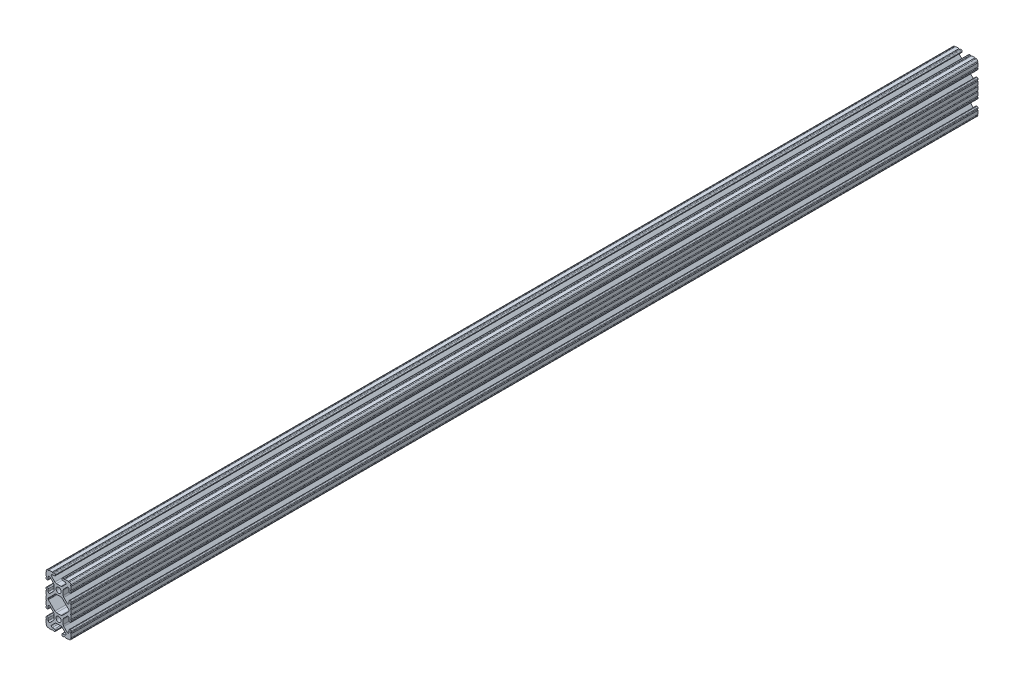
from build123d import *

# Parameters (mm, degrees)
BOSS_EXTRUDE1_DEPTH     = 457.2
CUT_EXTRUDE1_DEPTH      = 459.081095441
CUT_EXTRUDE1_DEPTH_BACK = 459.081095441
SKETCH5_R               = 0.55245
BOSS_EXTRUDE2_DEPTH     = 457.2
CUT_EXTRUDE2_DEPTH      = 459.081095441
CUT_EXTRUDE2_DEPTH_BACK = 459.081095441


with BuildPart() as part:
    # Sketch4 → Boss-Extrude1 (new, symmetric)
    with BuildSketch(Plane.XY):
        with BuildLine():
            Line((4.190365, -25.4), (10.11729625, -25.4))
            ThreePointArc((10.11729625, -25.4), (11.943543585, -24.643543585), (12.7, -22.81729625))
            Line((12.7, -22.81729625), (12.7, -16.890365))
            ThreePointArc((12.7, -16.890365), (12.42492494, -16.22627506), (11.760835, -15.9512))
            Line((11.760835, -15.9512), (11.429365, -15.9512))
            ThreePointArc((11.429365, -15.9512), (10.76527506, -16.22627506), (10.4902, -16.890365))
            Line((10.4902, -16.890365), (10.4902, -19.048478019))
            ThreePointArc((10.4902, -19.048478019), (9.830707141, -20.035478831), (8.666460301, -19.803895736))
            Line((8.666460301, -19.803895736), (5.299899128, -16.437334563))
            ThreePointArc((5.299899128, -16.437334563), (4.817571085, -15.715479634), (4.6482, -14.86399369))
            Line((4.6482, -14.86399369), (4.6482, -12.7))
            Line((4.6482, -12.7), (2.6035, -12.7))
            ThreePointArc((2.6035, -12.7), (1.840952505, -14.540952505), (0, -15.3035))
            Line((0, -15.3035), (0, -17.3482))
            Line((0, -17.3482), (2.16399369, -17.3482))
            ThreePointArc((2.16399369, -17.3482), (3.015479634, -17.517571085), (3.737334563, -17.999899128))
            Line((3.737334563, -17.999899128), (7.103895736, -21.366460301))
            ThreePointArc((7.103895736, -21.366460301), (7.335478831, -22.530707141), (6.348478019, -23.1902))
            Line((6.348478019, -23.1902), (4.190365, -23.1902))
            ThreePointArc((4.190365, -23.1902), (3.52627506, -23.46527506), (3.2512, -24.129365))
            Line((3.2512, -24.129365), (3.2512, -24.460835))
            ThreePointArc((3.2512, -24.460835), (3.52627506, -25.12492494), (4.190365, -25.4))
        make_face()
    extrude(amount=BOSS_EXTRUDE1_DEPTH, both=True)

    # Sketch5 → Cut-Extrude1 (cut, two sides: drawn at the far end of the back side and taken through both)
    with BuildSketch(Plane.XY.offset(-CUT_EXTRUDE1_DEPTH_BACK)):
        with Locations((10.356153152, -25.4)):
            Circle(SKETCH5_R)
        with Locations((5.796028019, -25.4)):
            Circle(SKETCH5_R)
        with Locations((12.7, -23.056153152)):
            Circle(SKETCH5_R)
        with Locations((12.7, -18.496028019)):
            Circle(SKETCH5_R)
    extrude(amount=CUT_EXTRUDE1_DEPTH + CUT_EXTRUDE1_DEPTH_BACK, mode=Mode.SUBTRACT)

    # Mirror1: part across plane


with BuildPart() as part_1:
    add(part.part)
    add(part.part.mirror(Plane(origin=(4.6482, -12.7, 457.2), x_dir=(0, 0, 1), z_dir=(0, -1, 0))))

    # Sketch6 → Boss-Extrude2 (add, symmetric)
    with BuildSketch(Plane.XY):
        with BuildLine():
            Line((12.7, -1.791396848), (12.7, 0))
            Line((12.7, 0), (9.803703152, 0))
            Line((9.803703152, 0), (9.803703152, -2.343846848))
            Line((9.803703152, -2.343846848), (12.14755, -2.343846848))
            ThreePointArc((12.14755, -2.343846848), (12.309358859, -1.953205706), (12.7, -1.791396848))
        make_face()
    extrude(amount=BOSS_EXTRUDE2_DEPTH, both=True)

    # Sketch7 → Cut-Extrude2 (cut, two sides: drawn at the far end of the back side and taken through both)
    with BuildSketch(Plane.XY.offset(-CUT_EXTRUDE2_DEPTH_BACK)):
        with BuildLine():
            Line((5.420615149, -5.716820286), (10.328391141, -0.809044294))
            ThreePointArc((10.328391141, -0.809044294), (10.448147248, -0.629816615), (10.4902, -0.418403152))
            Line((10.4902, -0.418403152), (10.4902, 0))
            Line((10.4902, 0), (0, 0))
            Line((0, 0), (5.420615149, -5.716820286))
        make_face()
    extrude(amount=CUT_EXTRUDE2_DEPTH + CUT_EXTRUDE2_DEPTH_BACK, mode=Mode.SUBTRACT)

    # Mirror2: part across plane


with BuildPart() as part_2:
    add(part_1.part)
    add(part_1.part.mirror(Plane.ZX))

    # Mirror3: part across plane


with BuildPart() as part_3:
    add(part_2.part)
    add(part_2.part.mirror(Plane(origin=(0, 0, 0), x_dir=(0, 0, 1), z_dir=(1, 0, 0))))


solid = part_3.part
